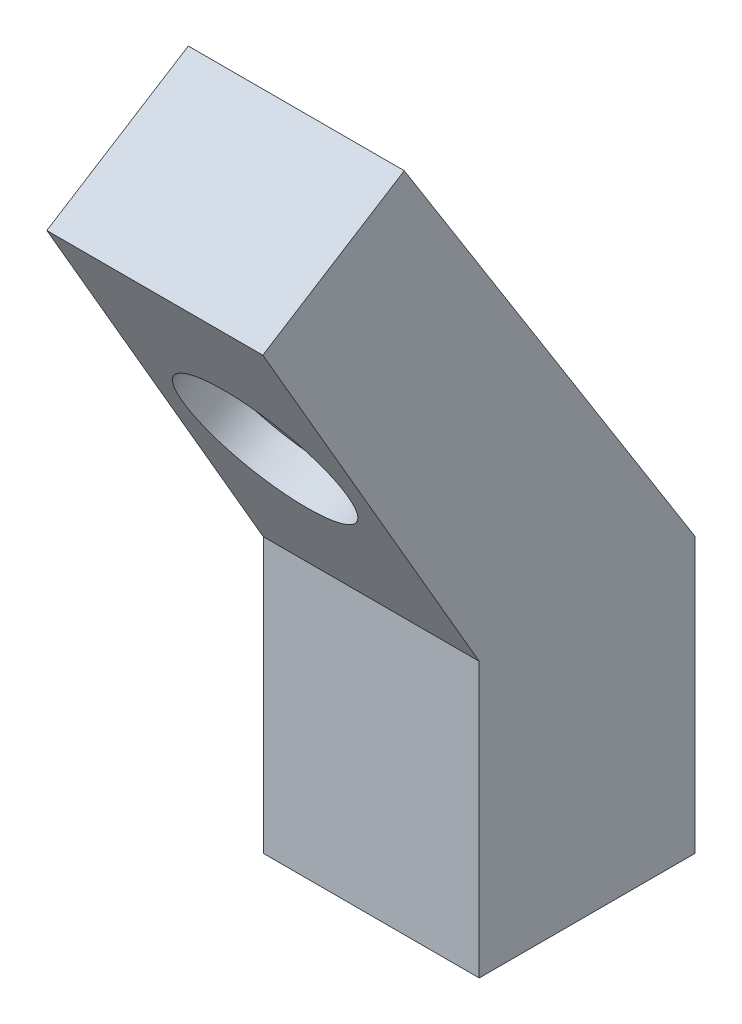
from build123d import *

# Parameters (mm, degrees)
BOSS_EXTRUDE1_DEPTH = 203.2
BOSS_EXTRUDE2_DEPTH = 160.02
SKETCH5_R           = 61.468
CUT_EXTRUDE1_DEPTH  = 25.4


with BuildPart() as part:
    # Sketch1 → Boss-Extrude1 (new body)
    with BuildSketch(Plane(origin=(0, 0, 0), x_dir=(1, 0, 0), z_dir=(0, 1, 0))):
        Polygon((0, 80), (-80, 80), (-80, 0), (-80, -80), (0, -80), (80, -80), (80, 0), (80, 80), align=None)
    extrude(amount=BOSS_EXTRUDE1_DEPTH)

    # Sketch4 → Boss-Extrude2 (add)
    with BuildSketch(Plane(origin=(80, 0, 0), x_dir=(0, 0, -1), z_dir=(1, 0, 0))):
        Polygon((80, 203.2), (-135.526146906, 545.726146906), (-240.337405258, 479.776242441), (-80, 203.2), align=None)
    extrude(amount=-BOSS_EXTRUDE2_DEPTH)

    # Sketch5 → Cut-Extrude1 (cut)
    with BuildSketch(Plane(origin=(0, 16.401175936, -28.291437078), x_dir=(1, 0, 0), z_dir=(0, -0.5015382826017037, 0.8651354524494611))):
        with Locations(Location((0, 372.618160976, 0), (0, 0, 270))):
            Circle(SKETCH5_R)
    extrude(amount=-CUT_EXTRUDE1_DEPTH, mode=Mode.SUBTRACT)


solid = part.part
